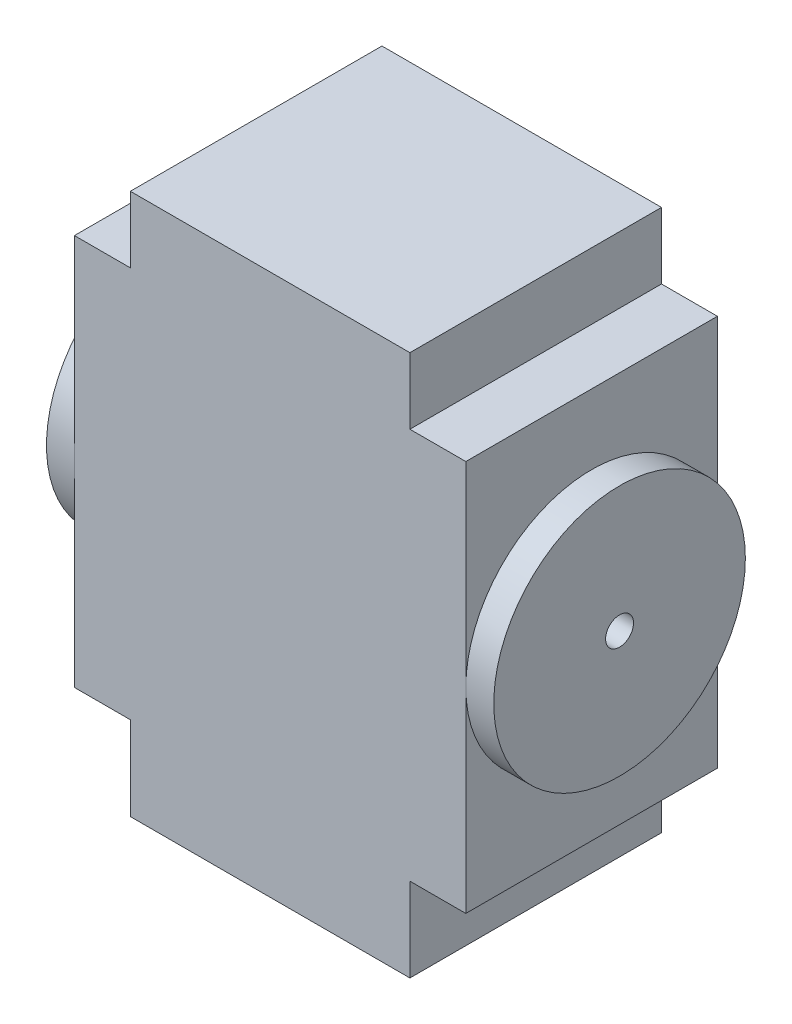
from build123d import *

# Parameters (mm, degrees)
SKETCH_4_W          = 5
SKETCH_4_H          = 10
EXTRUDE_2_DEPTH     = 4.5
SKETCH_5_W          = 4.5
SKETCH_5_H          = 7
EXTRUDE_3_DEPTH     = 1
SKETCH_6_W          = 4.5
SKETCH_6_H          = 7
EXTRUDE_4_DEPTH     = 1
SKETCH_7_R          = 2.25
EXTRUDE_5_DEPTH     = 0.5
SKETCH_8_R          = 0.25
CUT_EXTRUDE_1_DEPTH = 0.5
CUT_EXTRUDE_START   = -0.5
SKETCH_9_R          = 0.25
CUT_EXTRUDE_2_DEPTH = 0.5
SCALE_1_SCALE       = 3.181818182
SCALE_2_SCALE       = 2.454545455
SCALE_3_SCALE       = 0.771428571
SCALE_4_SCALE       = 0.407393437
SKETCH_10_W         = 14.212580929
SKETCH_10_H         = 3.204768758
CUT_EXTRUDE_3_DEPTH = 20.209197968


with BuildPart() as part:
    # 草图4 → 凸台-拉伸2 (new body)
    with BuildSketch(Plane.XY):
        Rectangle(SKETCH_4_W, SKETCH_4_H)
    extrude(amount=EXTRUDE_2_DEPTH)

    # 草图5 → 凸台-拉伸3 (add)
    with BuildSketch(Plane(origin=(2.5, 0, 0), x_dir=(0, 0, -1), z_dir=(1, 0, 0))):
        with Locations((-2.25, 0)):
            Rectangle(SKETCH_5_W, SKETCH_5_H)
    extrude(amount=EXTRUDE_3_DEPTH)

    # 草图6 → 凸台-拉伸4 (add)
    with BuildSketch(Plane.ZY.offset(2.5)):
        with Locations((2.25, 0)):
            Rectangle(SKETCH_6_W, SKETCH_6_H)
    extrude(amount=EXTRUDE_4_DEPTH)

    # 草图7 → 凸台-拉伸5 (add)
    with BuildSketch(Plane(origin=(3.5, 0, 0), x_dir=(0, 0, -1), z_dir=(1, 0, 0))):
        with Locations((-2.25, 0)):
            Circle(SKETCH_7_R)
    extrude_5 = extrude(amount=EXTRUDE_5_DEPTH)

    # 镜向1: 凸台-拉伸5 across plane
    add(extrude_5.mirror(Plane(origin=(0, 0, 0), x_dir=(0, 0, 1), z_dir=(1, 0, 0))))

    # 草图8 → 切除-拉伸1 (cut)
    with BuildSketch(Plane(origin=(4, 0, 0), x_dir=(0, 0, -1), z_dir=(1, 0, 0))):
        with Locations((-2.25, 0)):
            Circle(SKETCH_8_R)
    extrude(amount=-CUT_EXTRUDE_1_DEPTH, mode=Mode.SUBTRACT)

    # 草图9 → 切除-拉伸2 (cut)
    with BuildSketch(Plane.ZY.offset(4).offset(CUT_EXTRUDE_START)):
        with Locations(Location((2.25, 0, 0), (0, 0, 180))):
            Circle(SKETCH_9_R)
    extrude(amount=CUT_EXTRUDE_2_DEPTH, mode=Mode.SUBTRACT)


with BuildPart() as part_1:
    # 缩放比例1: scaled about (0, 0, 2.25)
    add(part.part.scale(SCALE_1_SCALE).moved(Location((0, 0, -4.909090909))))


with BuildPart() as part_2:
    # 缩放比例2: scaled about (0, 0, 2.25)
    add(part_1.part.scale(SCALE_2_SCALE).moved(Location((0, 0, -3.272727273))))


with BuildPart() as part_3:
    # 缩放比例3: scaled about (0, 0, 2.25)
    add(part_2.part.scale(SCALE_3_SCALE).moved(Location((0, 0, 0.514285714))))


with BuildPart() as part_4:
    # 缩放比例4: scaled about (0, 0, 2.25)
    add(part_3.part.scale(SCALE_4_SCALE).moved(Location((0, 0, 1.333364768))))

    # 草图10 → 切除-拉伸3 (cut, through all)
    with BuildSketch(Plane(origin=(0, 0, -3.272537886), x_dir=(-1, 0, 0), z_dir=(0, 0, -1))):
        with Locations((0.970137257, 13.104690793)):
            Rectangle(SKETCH_10_W, SKETCH_10_H)
    extrude(amount=-CUT_EXTRUDE_3_DEPTH, mode=Mode.SUBTRACT)


solid = part_4.part
